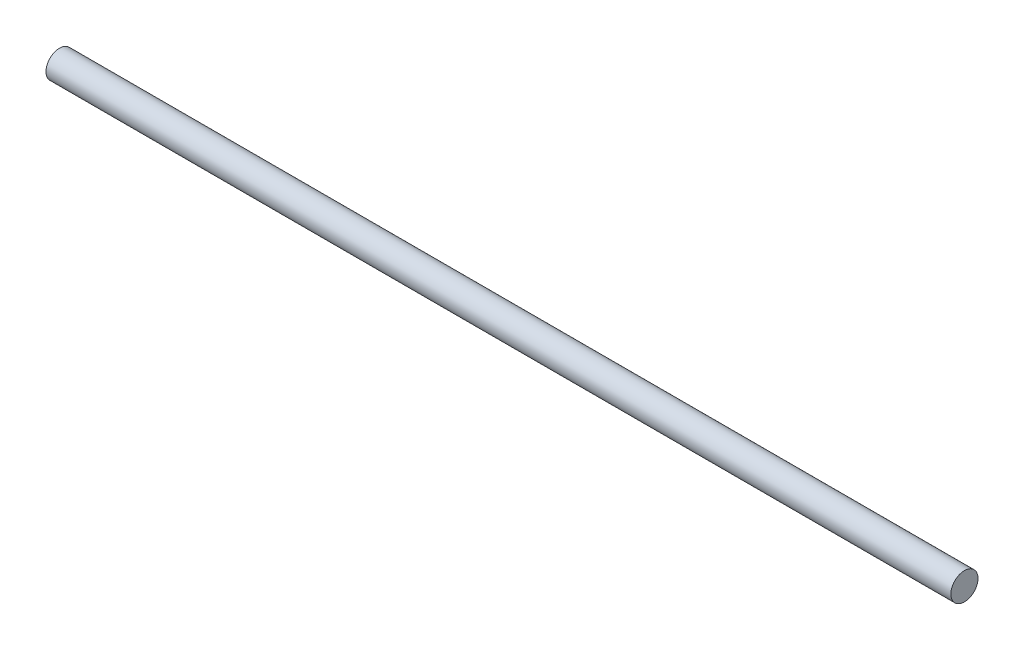
from build123d import *

# Parameters (mm, degrees)
ESQUISSE1_R        = 15
BOSS_EXTRU_1_DEPTH = 1000


with BuildPart() as part:
    # Esquisse1 → Boss.-Extru.1 (new body)
    with BuildSketch(Plane(origin=(0, 0, 0), x_dir=(0, 0, -1), z_dir=(1, 0, 0))):
        Circle(ESQUISSE1_R)
    extrude(amount=BOSS_EXTRU_1_DEPTH)


solid = part.part
